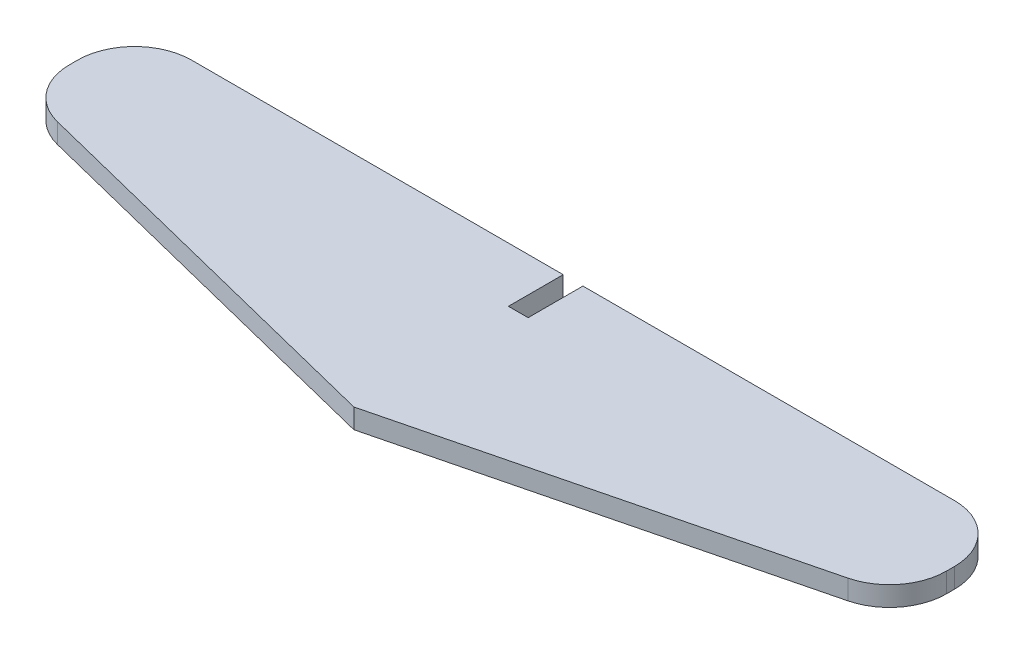
from build123d import *

# Parameters (mm, degrees)
BOSS_EXTRUDE1_DEPTH = 4.5
FILLET1_R           = 13


with BuildPart() as part:
    # Sketch1 → Boss-Extrude1 (new body)
    with BuildSketch(Plane(origin=(0, 0, 0), x_dir=(1, 0, 0), z_dir=(0, 1, 0))):
        Polygon((110.219806784, 25), (110.219806784, 50), (12.469806784, 50), (12.469806784, 37.5), (7.969806784, 37.5), (7.969806784, 50), (-89.780193216, 50), (-89.780193216, 25), (10.219806784, 0), align=None)
    extrude(amount=BOSS_EXTRUDE1_DEPTH)

    # Fillet1
    fillet1_edges = [part.edges().sort_by_distance(p)[0] for p in [
        (110.219806784, 2.25, -50),
        (110.219806784, 2.25, -25),
        (-89.780193216, 2.25, -25),
        (-89.780193216, 2.25, -50),
    ]]
    fillet(fillet1_edges, radius=FILLET1_R)


solid = part.part
